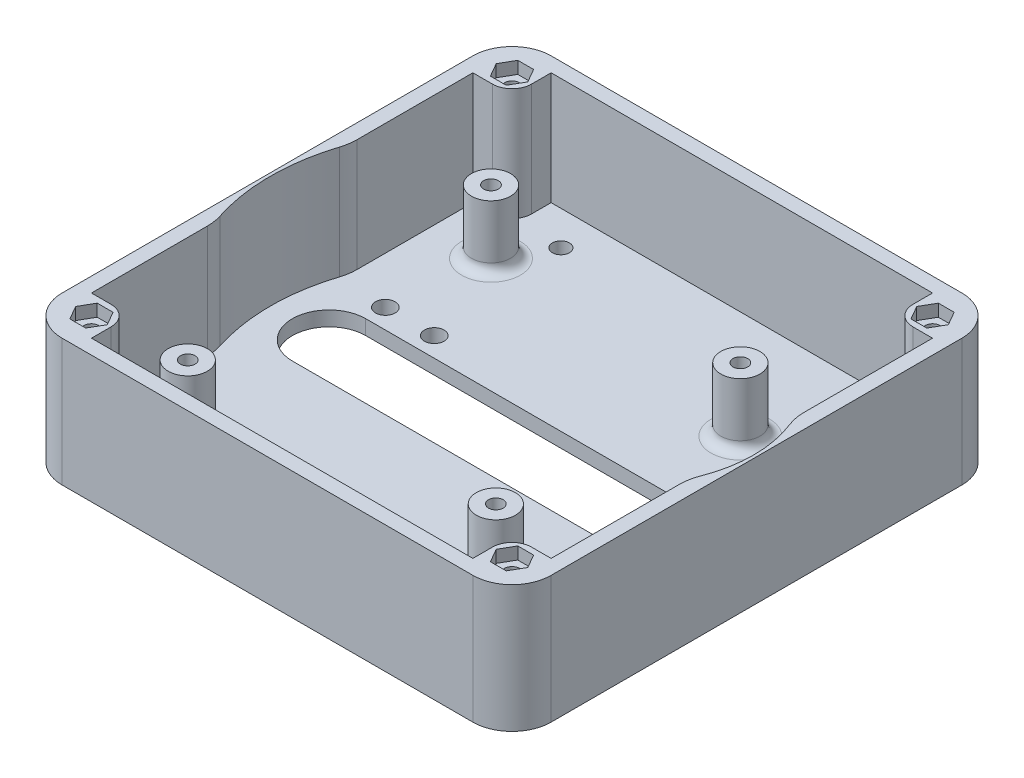
from build123d import *

# Parameters (mm, degrees)
SKETCH_1_W          = 100
SKETCH_1_H          = 100
SKETCH_1_R          = 1.5
EXTRUDE_1_DEPTH     = 3
SKETCH_4_W          = 100
SKETCH_4_H          = 100
EXTRUDE_4_DEPTH     = 23
SKETCH_5_R          = 4
SKETCH_5_R_2        = 1.5
EXTRUDE_5_DEPTH     = 13
FILLET_2_R          = 2
FILLET_3_R          = 8
SKETCH_7_R          = 1.5
EXTRUDE_6_DEPTH     = 23
SKETCH_8_R          = 1.75
SKETCH_8_R_2        = 2
CUT_EXTRUDE_2_DEPTH = 3
SKETCH_9_R          = 3.25
CUT_EXTRUDE_3_DEPTH = 2.5
CUT_EXTRUDE_4_DEPTH = 2.5


with BuildPart() as part:
    # Эскиз1 → Бобышка-Вытянуть1 (new body)
    with BuildSketch(Plane(origin=(0, 0, 0), x_dir=(1, 0, 0), z_dir=(0, 1, 0))):
        with Locations((50, 50)):
            Rectangle(SKETCH_1_W, SKETCH_1_H)
        with Locations(Location((14.7, 81, 0), (0, 0, 270))):
            Circle(SKETCH_1_R, mode=Mode.SUBTRACT)
        with Locations(Location((71.7, 75, 0), (0, 0, 270))):
            Circle(SKETCH_1_R, mode=Mode.SUBTRACT)
        with Locations(Location((71.7, 25, 0), (0, 0, 90))):
            Circle(SKETCH_1_R, mode=Mode.SUBTRACT)
        with Locations(Location((14.7, 19, 0), (0, 0, 90))):
            Circle(SKETCH_1_R, mode=Mode.SUBTRACT)
        with Locations(Location((7, 93, 0), (0, 0, 270))):
            Circle(SKETCH_1_R, mode=Mode.SUBTRACT)
        with Locations(Location((93, 93, 0), (0, 0, 90))):
            Circle(SKETCH_1_R, mode=Mode.SUBTRACT)
        with Locations(Location((93, 7, 0), (0, 0, 270))):
            Circle(SKETCH_1_R, mode=Mode.SUBTRACT)
        with Locations(Location((7, 7, 0), (0, 0, 90))):
            Circle(SKETCH_1_R, mode=Mode.SUBTRACT)
    extrude(amount=EXTRUDE_1_DEPTH)

    # Эскиз4 → Бобышка-Вытянуть4 (add)
    with BuildSketch(Plane(origin=(0, 3, 0), x_dir=(1, 0, 0), z_dir=(0, 1, 0))):
        with Locations((50, 50)):
            Rectangle(SKETCH_4_W, SKETCH_4_H)
        with BuildLine():
            Line((97, 97), (3, 97))
            Line((3, 97), (3, 65.304901176))
            ThreePointArc((3, 65.304901176), (2.879271228, 63.755707837), (2.52, 62.243920941))
            ThreePointArc((2.52, 62.243920941), (0.6, 50), (2.52, 37.756079059))
            ThreePointArc((2.52, 37.756079059), (2.879271228, 36.244292163), (3, 34.695098824))
            Line((3, 34.695098824), (3, 3))
            Line((3, 3), (97, 3))
            Line((97, 3), (97, 37.262653338))
            ThreePointArc((97, 37.262653338), (97.172923702, 39.114293537), (97.685714286, 40.901895241))
            ThreePointArc((97.685714286, 40.901895241), (99.4, 50), (97.685714286, 59.098104759))
            ThreePointArc((97.685714286, 59.098104759), (97.172923702, 60.885706463), (97, 62.737346662))
            Line((97, 62.737346662), (97, 97))
        make_face(mode=Mode.SUBTRACT)
    extrude(amount=EXTRUDE_4_DEPTH)

    # Эскиз5 → Бобышка-Вытянуть5 (add)
    # profile 1 of 4: a face of its own
    with BuildSketch(Plane(origin=(0, 3, 0), x_dir=(1, 0, 0), z_dir=(0, 1, 0))):
        with Locations(Location((14.7, 81, 0), (0, 0, 90))):
            Circle(SKETCH_5_R)
        with Locations(Location((14.7, 81, 0), (0, 0, 270))):
            Circle(SKETCH_5_R_2, mode=Mode.SUBTRACT)
    # profile 2 of 4: a face of its own
    with BuildSketch(Plane(origin=(0, 3, 0), x_dir=(1, 0, 0), z_dir=(0, 1, 0))):
        with Locations(Location((71.7, 75, 0), (0, 0, 90))):
            Circle(SKETCH_5_R)
        with Locations(Location((71.7, 75, 0), (0, 0, 270))):
            Circle(SKETCH_5_R_2, mode=Mode.SUBTRACT)
    # profile 3 of 4: a face of its own
    with BuildSketch(Plane(origin=(0, 3, 0), x_dir=(1, 0, 0), z_dir=(0, 1, 0))):
        with Locations(Location((71.7, 25, 0), (0, 0, 90))):
            Circle(SKETCH_5_R)
        with Locations(Location((71.7, 25, 0), (0, 0, 90))):
            Circle(SKETCH_5_R_2, mode=Mode.SUBTRACT)
    # profile 4 of 4: a face of its own
    with BuildSketch(Plane(origin=(0, 3, 0), x_dir=(1, 0, 0), z_dir=(0, 1, 0))):
        with Locations(Location((14.7, 19, 0), (0, 0, 90))):
            Circle(SKETCH_5_R)
        with Locations(Location((14.7, 19, 0), (0, 0, 90))):
            Circle(SKETCH_5_R_2, mode=Mode.SUBTRACT)
    extrude(amount=EXTRUDE_5_DEPTH)

    # Скругление2
    fillet_2_edges = [part.edges().sort_by_distance(p)[0] for p in [
        (71.7, 3, -21),
        (14.7, 3, -15),
        (14.7, 3, -77),
        (71.7, 3, -71),
    ]]
    fillet(fillet_2_edges, radius=FILLET_2_R)

    # Скругление3
    fillet_3_edges = [part.edges().sort_by_distance(p)[0] for p in [
        (0, 13, -100),
        (100, 13, -100),
        (100, 13, 0),
        (0, 13, 0),
    ]]
    fillet(fillet_3_edges, radius=FILLET_3_R)

    # Эскиз7 → Бобышка-Вытянуть6 (add)
    # profile 1 of 4: a face of its own
    with BuildSketch(Plane(origin=(0, 3, 0), x_dir=(1, 0, 0), z_dir=(0, 1, 0))):
        with BuildLine():
            Line((3, 89), (3, 97))
            Line((3, 97), (11, 97))
            Line((11, 97), (11, 93))
            ThreePointArc((11, 93), (9.828427125, 90.171572875), (7, 89))
            Line((7, 89), (3, 89))
        make_face()
        with Locations(Location((7, 93, 0), (0, 0, 270))):
            Circle(SKETCH_7_R, mode=Mode.SUBTRACT)
    # profile 2 of 4: a face of its own
    with BuildSketch(Plane(origin=(0, 3, 0), x_dir=(1, 0, 0), z_dir=(0, 1, 0))):
        with BuildLine():
            Line((89, 93), (89, 97))
            Line((89, 97), (97, 97))
            Line((97, 97), (97, 89))
            Line((97, 89), (93, 89))
            ThreePointArc((93, 89), (90.171572875, 90.171572875), (89, 93))
        make_face()
        with Locations(Location((93, 93, 0), (0, 0, 90))):
            Circle(SKETCH_7_R, mode=Mode.SUBTRACT)
    # profile 3 of 4: a face of its own
    with BuildSketch(Plane(origin=(0, 3, 0), x_dir=(1, 0, 0), z_dir=(0, 1, 0))):
        with BuildLine():
            Line((97, 11), (97, 3))
            Line((97, 3), (89, 3))
            Line((89, 3), (89, 7))
            ThreePointArc((89, 7), (90.171572875, 9.828427125), (93, 11))
            Line((93, 11), (97, 11))
        make_face()
        with Locations(Location((93, 7, 0), (0, 0, 270))):
            Circle(SKETCH_7_R, mode=Mode.SUBTRACT)
    # profile 4 of 4: a face of its own
    with BuildSketch(Plane(origin=(0, 3, 0), x_dir=(1, 0, 0), z_dir=(0, 1, 0))):
        with BuildLine():
            Line((11, 7), (11, 3))
            Line((11, 3), (3, 3))
            Line((3, 3), (3, 11))
            Line((3, 11), (7, 11))
            ThreePointArc((7, 11), (9.828427125, 9.828427125), (11, 7))
        make_face()
        with Locations(Location((7, 7, 0), (0, 0, 90))):
            Circle(SKETCH_7_R, mode=Mode.SUBTRACT)
    extrude(amount=EXTRUDE_6_DEPTH)

    # Эскиз8 → Вырез-Вытянуть2 (cut)
    with BuildSketch(Plane(origin=(0, 3, 0), x_dir=(1, 0, 0), z_dir=(0, 1, 0))):
        with Locations(Location((20, 90, 0), (0, 0, 270))):
            Circle(SKETCH_8_R)
        with Locations(Location((80, 90, 0), (0, 0, 90))):
            Circle(SKETCH_8_R)
        with Locations(Location((80, 10, 0), (0, 0, 270))):
            Circle(SKETCH_8_R)
        with Locations(Location((20, 10, 0), (0, 0, 90))):
            Circle(SKETCH_8_R)
        with Locations(Location((22.592071992, 61.508405751, 0), (0, 0, 270))):
            Circle(SKETCH_8_R_2)
        with Locations(Location((12.592071992, 61.508405751, 0), (0, 0, 270))):
            Circle(SKETCH_8_R_2)
        with BuildLine():
            Line((12.592071992, 57.5), (87.592071992, 57.5))
            ThreePointArc((87.592071992, 57.5), (95.092071992, 50), (87.592071992, 42.5))
            Line((87.592071992, 42.5), (12.592071992, 42.5))
            ThreePointArc((12.592071992, 42.5), (5.092071992, 50), (12.592071992, 57.5))
        make_face()
    extrude(amount=-CUT_EXTRUDE_2_DEPTH, mode=Mode.SUBTRACT)

    # Эскиз9 → Вырез-Вытянуть3 (cut)
    with BuildSketch(Plane.XZ):
        with Locations(Location((7, -7, 0), (0, 0, 270))):
            Circle(SKETCH_9_R)
        with Locations(Location((93, -7, 0), (0, 0, 270))):
            Circle(SKETCH_9_R)
        with Locations(Location((93, -93, 0), (0, 0, 270))):
            Circle(SKETCH_9_R)
        with Locations(Location((7, -93, 0), (0, 0, 270))):
            Circle(SKETCH_9_R)
    extrude(amount=-CUT_EXTRUDE_3_DEPTH, mode=Mode.SUBTRACT)

    # Эскиз10 → Вырез-Вытянуть4 (cut)
    with BuildSketch(Plane(origin=(0, 26, 0), x_dir=(1, 0, 0), z_dir=(0, 1, 0))):
        Polygon((8.616580754, 90.2), (10.233161507, 93), (8.616580754, 95.8), (5.383419246, 95.8), (3.766838493, 93), (5.383419246, 90.2), align=None)
        Polygon((94.616580754, 90.2), (91.383419246, 90.2), (89.766838493, 93), (91.383419246, 95.8), (94.616580754, 95.8), (96.233161507, 93), align=None)
        Polygon((91.383419246, 9.8), (89.766838493, 7), (91.383419246, 4.2), (94.616580754, 4.2), (96.233161507, 7), (94.616580754, 9.8), align=None)
        Polygon((5.383419246, 9.8), (8.616580754, 9.8), (10.233161507, 7), (8.616580754, 4.2), (5.383419246, 4.2), (3.766838493, 7), align=None)
    extrude(amount=-CUT_EXTRUDE_4_DEPTH, mode=Mode.SUBTRACT)


solid = part.part
